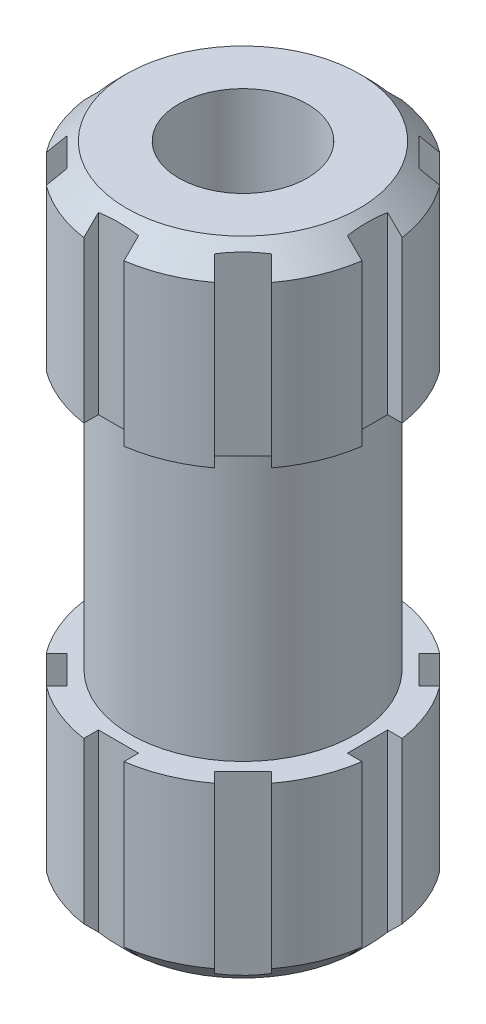
from build123d import *

# Parameters (mm, degrees)
CHANFRO2_SIZE         = 0.3
CORTE_EXTRUS_O2_REACH = 10.374
ESBO_O7_W             = 0.5
ESBO_O7_H             = 0.2
PADR_OCIRCULAR1_COUNT = 8
M2X0_4_TAPPED_HOLE1_D = 1.6


with BuildPart() as part:
    # Esboço2 → Revolução1 (revolve)
    with BuildSketch(Plane.XY, mode=Mode.PRIVATE) as revolu_o1_sk:
        Polygon((0, 8), (1.75, 8), (1.75, 5.7), (1.4, 5.7), (1.4, 2.3), (1.75, 2.3), (1.75, 0), (0, 0), align=None)
    revolve(revolu_o1_sk.sketch.rotate(Axis((0, 0, 0), (0, 1, 0)), 90), axis=Axis((0, 0, 0), (0, 1, 0)))

    # Chanfro2
    chanfro2_edges = [part.edges().sort_by_distance(p)[0] for p in [
        (0, 0, 1.75),
        (0, 8, 1.75),
    ]]
    chamfer(chanfro2_edges, length=CHANFRO2_SIZE)

    # Corte-extrusão2: up to this face of the body (flat: up to its plane)
    corte_extrus_o2_end = Plane(part.part.faces().sort_by_distance((0, 0, 0))[0])
    # Esboço7 → Corte-extrusão2 (cut, up to the picked face)
    with BuildSketch(Plane(origin=(0, 8, 0), x_dir=(1, 0, 0), z_dir=(0, 1, 0)), mode=Mode.PRIVATE) as corte_extrus_o2_sk1:
        with Locations((0, 1.65)):
            Rectangle(ESBO_O7_W, ESBO_O7_H)
    corte_extrus_o2_tool1 = split(extrude(corte_extrus_o2_sk1.sketch, amount=-CORTE_EXTRUS_O2_REACH, mode=Mode.PRIVATE), bisect_by=corte_extrus_o2_end, keep=Keep.BOTH, mode=Mode.PRIVATE)
    corte_extrus_o2 = corte_extrus_o2_tool1.solids().sort_by(Axis((0, 8, -1.65), (0, -1, 0)))[0]
    add(corte_extrus_o2, mode=Mode.SUBTRACT)

    # PadrãoCircular1: Corte-extrusão2 ×8 about axis
    padr_ocircular1_axis = Axis((0, 0, 0), (0, 1, 0))
    for i in range(1, PADR_OCIRCULAR1_COUNT):
        add(corte_extrus_o2.rotate(padr_ocircular1_axis, i * 360 / PADR_OCIRCULAR1_COUNT), mode=Mode.SUBTRACT)

    # M2x0.4 Tapped Hole1 (through all)
    with Locations(Plane(origin=(0, 8, 0), x_dir=(1, 0, 0), z_dir=(0, 1, 0))):
        with Locations((0, 0)):
            Hole(M2X0_4_TAPPED_HOLE1_D / 2)


solid = part.part
